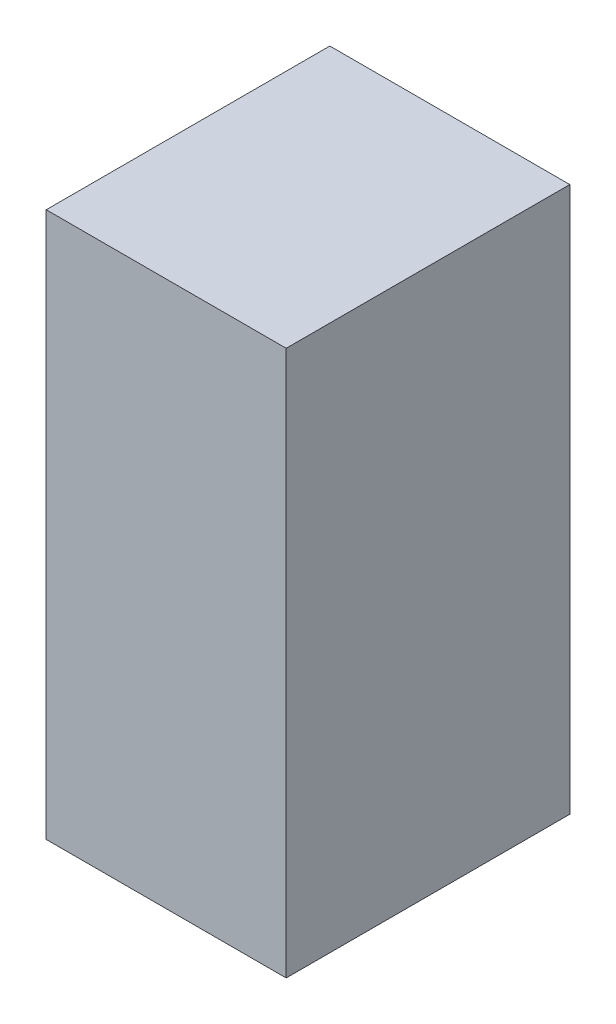
from build123d import *

# Parameters (mm, degrees)
SKETCH_2_W          = 22
SKETCH_2_H          = 50
EXTRUDE_1_DEPTH     = 3
EXTRUDE_2_DEPTH     = 20
CUT_EXTRUDE_1_DEPTH = 1
SKETCH_4_3_R        = 0.5
CUT_EXTRUDE_2_DEPTH = 2
SKETCH_5_W          = 22
SKETCH_5_H          = 50
EXTRUDE_3_DEPTH     = 3
SKETCH_8_R          = 0.5
CUT_EXTRUDE_3_DEPTH = 1.2
SKETCH_9_R          = 0.75
EXTRUDE_4_DEPTH     = 2
SCALE_1_SCALE       = 10


with BuildPart() as part:
    # 草图2 → 凸台-拉伸1 (new body)
    with BuildSketch(Plane.XY):
        Rectangle(SKETCH_2_W, SKETCH_2_H)
    extrude(amount=EXTRUDE_1_DEPTH)

    # 草图3 → 凸台-拉伸2 (add)
    with BuildSketch(Plane.XY.offset(3)):
        Polygon((-11, 20.230452477), (-10.5, 20.230452477), (-10.5, 24.5), (10.5, 24.5), (10.5, -24.5), (-10.5, -24.5), (-10.5, -19.769547523), (-11, -19.769547523), (-11, -25), (11, -25), (11, 25), (-11, 25), align=None)
    extrude(amount=EXTRUDE_2_DEPTH)

    # 草图4 → 切除-拉伸1 (cut)
    with BuildSketch(Plane.XY.offset(3)):
        with BuildLine():
            Line((7.579070714, -17.85), (7.579070714, 17.85))
            ThreePointArc((7.579070714, 17.85), (6.553944448, 20.324873734), (4.079070714, 21.35))
            Line((4.079070714, 21.35), (-3.920929286, 21.35))
            ThreePointArc((-3.920929286, 21.35), (-6.39580302, 20.324873734), (-7.420929286, 17.85))
            Line((-7.420929286, 17.85), (-7.420929286, -17.85))
            ThreePointArc((-7.420929286, -17.85), (-6.39580302, -20.324873734), (-3.920929286, -21.35))
            Line((-3.920929286, -21.35), (4.079070714, -21.35))
            ThreePointArc((4.079070714, -21.35), (6.553944448, -20.324873734), (7.579070714, -17.85))
        make_face()
        with BuildLine():
            Line((6.579070714, 17.85), (6.579070714, -17.85))
            ThreePointArc((6.579070714, -17.85), (5.846837667, -19.617766953), (4.079070714, -20.35))
            Line((4.079070714, -20.35), (-3.920929286, -20.35))
            ThreePointArc((-3.920929286, -20.35), (-5.688696239, -19.617766953), (-6.420929286, -17.85))
            Line((-6.420929286, -17.85), (-6.420929286, 17.85))
            ThreePointArc((-6.420929286, 17.85), (-5.688696239, 19.617766953), (-3.920929286, 20.35))
            Line((-3.920929286, 20.35), (4.079070714, 20.35))
            ThreePointArc((4.079070714, 20.35), (5.846837667, 19.617766953), (6.579070714, 17.85))
        make_face(mode=Mode.SUBTRACT)
    extrude(amount=-CUT_EXTRUDE_1_DEPTH, mode=Mode.SUBTRACT)

    # 草图4<3> → 切除-拉伸2 (cut)
    with BuildSketch(Plane.XY.offset(3)):
        with BuildLine():
            Line((6.079070714, -17.85), (6.079070714, 17.85))
            ThreePointArc((6.079070714, 17.85), (5.493284277, 19.264213562), (4.079070714, 19.85))
            Line((4.079070714, 19.85), (-3.920929286, 19.85))
            ThreePointArc((-3.920929286, 19.85), (-5.335142848, 19.264213562), (-5.920929286, 17.85))
            Line((-5.920929286, 17.85), (-5.920929286, -17.85))
            ThreePointArc((-5.920929286, -17.85), (-5.335142848, -19.264213562), (-3.920929286, -19.85))
            Line((-3.920929286, -19.85), (4.079070714, -19.85))
            ThreePointArc((4.079070714, -19.85), (5.493284277, -19.264213562), (6.079070714, -17.85))
        make_face()
        with Locations((-3.920929286, -17.85)):
            Circle(SKETCH_4_3_R, mode=Mode.SUBTRACT)
        with Locations((4.079070714, -17.85)):
            Circle(SKETCH_4_3_R, mode=Mode.SUBTRACT)
        with BuildLine():
            Line((5.079070714, 16.731966011), (5.079070714, -16.731966011))
            ThreePointArc((5.079070714, -16.731966011), (3.018410542, -16.789339828), (2.961036725, -18.85))
            Line((2.961036725, -18.85), (-2.802895297, -18.85))
            ThreePointArc((-2.802895297, -18.85), (-2.860269114, -16.789339828), (-4.920929286, -16.731966011))
            Line((-4.920929286, -16.731966011), (-4.920929286, 16.731966011))
            ThreePointArc((-4.920929286, 16.731966011), (-2.860269114, 16.789339828), (-2.802895297, 18.85))
            Line((-2.802895297, 18.85), (2.961036725, 18.85))
            ThreePointArc((2.961036725, 18.85), (3.018410542, 16.789339828), (5.079070714, 16.731966011))
        make_face(mode=Mode.SUBTRACT)
        with Locations((-3.920929286, 17.85)):
            Circle(SKETCH_4_3_R, mode=Mode.SUBTRACT)
        with Locations((4.079070714, 17.85)):
            Circle(SKETCH_4_3_R, mode=Mode.SUBTRACT)
    extrude(amount=-CUT_EXTRUDE_2_DEPTH, mode=Mode.SUBTRACT)

    # 草图5 → 凸台-拉伸3 (add)
    with BuildSketch(Plane.XY.offset(23)):
        Rectangle(SKETCH_5_W, SKETCH_5_H)
    extrude(amount=EXTRUDE_3_DEPTH)

    # 草图8 → 切除-拉伸3 (cut)
    with BuildSketch(Plane.XY.offset(3)):
        with Locations((4.079070714, -17.85)):
            Circle(SKETCH_8_R)
        with Locations((4.079070714, 17.85)):
            Circle(SKETCH_8_R)
        with Locations((-3.920929286, 17.85)):
            Circle(SKETCH_8_R)
        with Locations((-3.920929286, -17.85)):
            Circle(SKETCH_8_R)
    extrude(amount=-CUT_EXTRUDE_3_DEPTH, mode=Mode.SUBTRACT)

    # 草图9 → 凸台-拉伸4 (add)
    with BuildSketch(Plane.XZ.offset(25)):
        with Locations((0, 13)):
            Circle(SKETCH_9_R)
    extrude(amount=EXTRUDE_4_DEPTH)


with BuildPart() as part_1:
    # 缩放比例1: scaled about (0.58667368, -0.025272028, 13.505805339)
    add(part.part.scale(SCALE_1_SCALE).moved(Location((-5.28006312, 0.227448252, -121.552248051))))


solid = part_1.part
